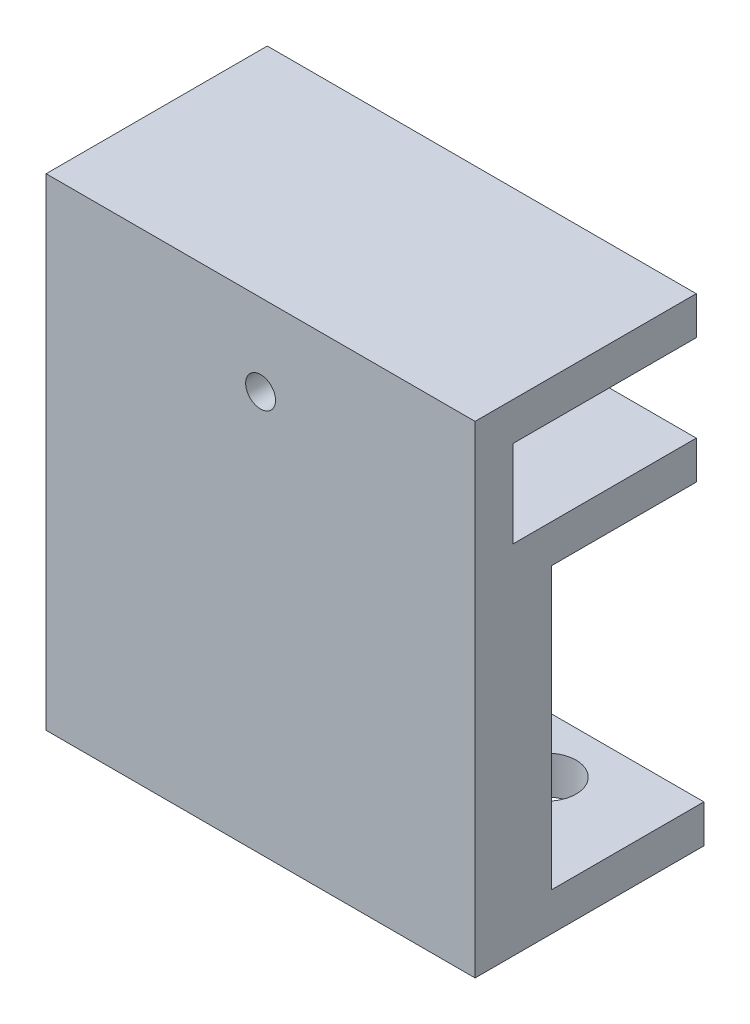
from build123d import *

# Parameters (mm, degrees)
BOSS_EXTRUDE1_DEPTH         = 35.7124
F_10_CLEARANCE_HOLE1_D      = 4.9784
F_3_8_CLEARANCE_HOLE1_D     = 9.8044
F_3_8_CLEARANCE_HOLE1_DEPTH = 6.35


with BuildPart() as part:
    # Sketch1 → Boss-Extrude1 (new, symmetric)
    with BuildSketch(Plane(origin=(0, 0, 0), x_dir=(0, 0, -1), z_dir=(1, 0, 0))):
        Polygon((24.13, 27.178), (-12.7, 27.178), (-12.7, 0), (-12.7, -53.086), (25.4, -53.086), (25.4, -46.736), (0, -46.736), (0, 0), (24.13, 0), (24.13, 6.35), (-6.35, 6.35), (-6.35, 20.828), (24.13, 20.828), align=None)
    extrude(amount=BOSS_EXTRUDE1_DEPTH, both=True)

    # #10 Clearance Hole1 (through all)
    with Locations(Plane.XY.offset(12.7)):
        with Locations((0, 13.589)):
            Hole(F_10_CLEARANCE_HOLE1_D / 2)

    # 3/8 Clearance Hole1
    with Locations(Plane(origin=(0, -53.086, 0), x_dir=(-1, 0, 0), z_dir=(0, -1, 0))):
        with Locations((-19.05, 15.875), (19.05, 15.875)):
            Hole(F_3_8_CLEARANCE_HOLE1_D / 2, depth=F_3_8_CLEARANCE_HOLE1_DEPTH)


solid = part.part
